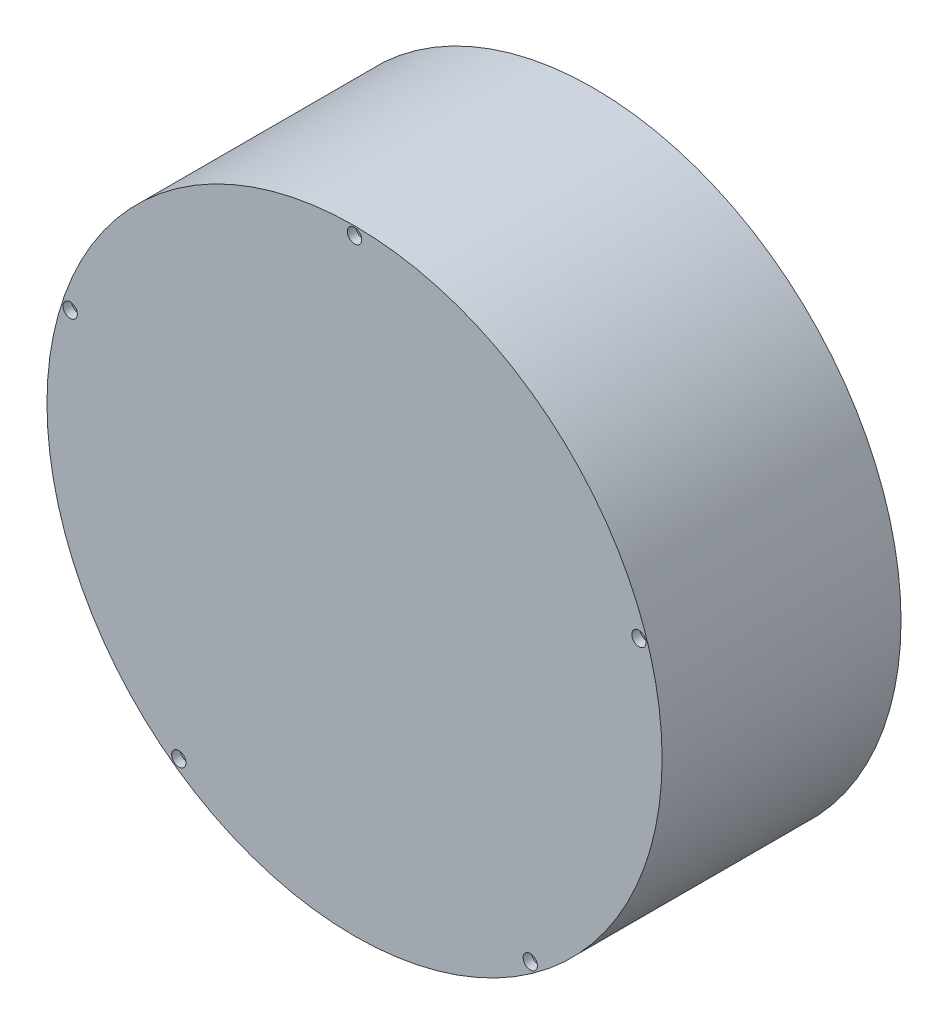
from build123d import *

# Parameters (mm, degrees)
SKETCH1_R              = 215
BODY_DEPTH             = 167
SKETCH2_R              = 212
CAVITY_DEPTH           = 157
SKETCH3_R              = 2.75
ROD_HOLES_DEPTH        = 10
SKETCH4_R              = 5
NUT_COUNTERBORES_DEPTH = 6


with BuildPart() as part:
    # Sketch1 → Body (new body)
    with BuildSketch(Plane.XY):
        with Locations(Location((0, 0, 0), (0, 0, 180))):
            Circle(SKETCH1_R)
    extrude(amount=BODY_DEPTH)

    # Sketch2 → Cavity (cut)
    with BuildSketch(Plane.XY):
        Circle(SKETCH2_R)
    extrude(amount=CAVITY_DEPTH, mode=Mode.SUBTRACT)

    # Sketch3 → Rod_holes (cut)
    with BuildSketch(Plane.XY.offset(157)):
        with Locations((198.770811906, 64.584551824)):
            Circle(SKETCH3_R)
        with Locations((0, 209)):
            Circle(SKETCH3_R)
        with Locations((-198.770811906, 64.584551824)):
            Circle(SKETCH3_R)
        with Locations((-122.847117729, -169.084551824)):
            Circle(SKETCH3_R)
        with Locations((122.847117729, -169.084551824)):
            Circle(SKETCH3_R)
    extrude(amount=ROD_HOLES_DEPTH, mode=Mode.SUBTRACT)

    # Sketch4 → Nut_counterbores (cut)
    with BuildSketch(Plane.XY.offset(161)):
        with Locations((198.770811906, 64.584551824)):
            Circle(SKETCH4_R)
        with Locations((0, 209)):
            Circle(SKETCH4_R)
        with Locations((-198.770811906, 64.584551824)):
            Circle(SKETCH4_R)
        with Locations((-122.847117729, -169.084551824)):
            Circle(SKETCH4_R)
        with Locations((122.847117729, -169.084551824)):
            Circle(SKETCH4_R)
    extrude(amount=NUT_COUNTERBORES_DEPTH, mode=Mode.SUBTRACT)


solid = part.part
